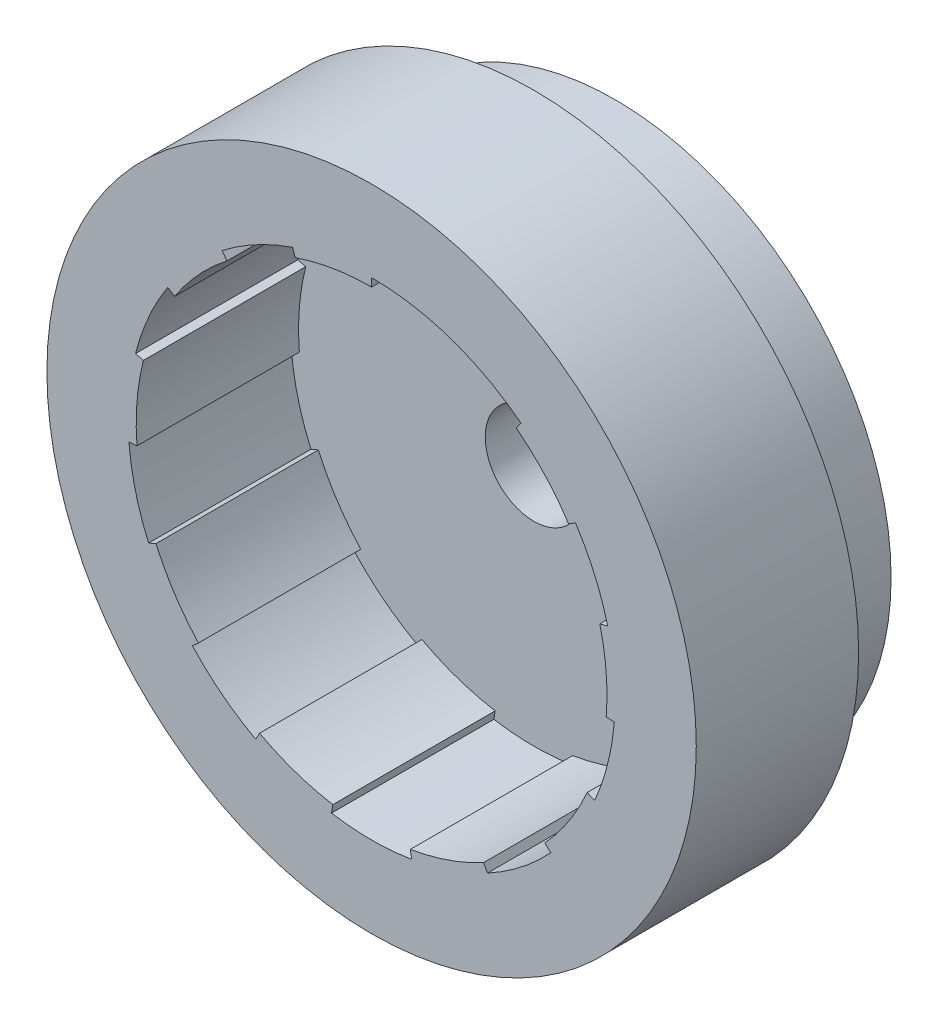
from build123d import *

# Parameters (mm, degrees)
SKETCH1_R           = 20
SKETCH1_R_2         = 15
BOSS_EXTRUDE2_DEPTH = 10
SKETCH2_R           = 17
BOSS_EXTRUDE4_DEPTH = 5
SKETCH5_R           = 3
CUT_EXTRUDE2_DEPTH  = 33.015621187


with BuildPart() as part:
    # Sketch1 → Boss-Extrude2 (new body)
    # profile 1 of 10: a face of its own
    with BuildSketch(Plane.XY):
        Circle(SKETCH1_R)
        Circle(SKETCH1_R_2, mode=Mode.SUBTRACT)
    # profile 2 of 10: a face of its own
    with BuildSketch(Plane.XY):
        with BuildLine():
            ThreePointArc((-4.708142303, 13.714350005), (-2.386621559, 14.302238899), (0, 14.5))
            Line((0, 14.5), (0, 15))
            ThreePointArc((0, 15), (-2.468918854, 14.795419551), (-4.870492038, 14.187258626))
            Line((-4.870492038, 14.187258626), (-4.708142303, 13.714350005))
        make_face()
    # profile 3 of 10: a face of its own
    with BuildSketch(Plane.XY):
        with BuildLine():
            Line((9.21319069, 11.837107641), (8.906084334, 11.442537386))
            ThreePointArc((8.906084334, 11.442537386), (10.667996705, 9.820582789), (12.138913935, 7.930748293))
            Line((12.138913935, 7.930748293), (12.557497174, 8.204222372))
            ThreePointArc((12.557497174, 8.204222372), (11.03585866, 10.159223574), (9.21319069, 11.837107641))
        make_face()
    # profile 4 of 10: a face of its own
    with BuildSketch(Plane.XY):
        with BuildLine():
            Line((14.541003989, 3.682282307), (14.056303856, 3.559539564))
            ThreePointArc((14.056303856, 3.559539564), (14.388648406, 1.793543153), (14.5, 0))
            ThreePointArc((14.5, 0), (14.487613497, -0.599212127), (14.450475149, -1.197400509))
            Line((14.450475149, -1.197400509), (14.948767395, -1.238690182))
            ThreePointArc((14.948767395, -1.238690182), (14.987186376, -0.619874614), (15, 0))
            ThreePointArc((15, 0), (14.884808696, 1.855389469), (14.541003989, 3.682282307))
        make_face()
    # profile 5 of 10: a face of its own
    with BuildSketch(Plane.XY):
        with BuildLine():
            Line((13.7365999, -6.02543137), (13.278713236, -5.824583657))
            ThreePointArc((13.278713236, -5.824583657), (12.138913935, -7.930748293), (10.667996705, -9.820582789))
            Line((10.667996705, -9.820582789), (11.03585866, -10.159223574))
            ThreePointArc((11.03585866, -10.159223574), (12.557497174, -8.204222372), (13.7365999, -6.02543137))
        make_face()
    # profile 6 of 10: a face of its own
    with BuildSketch(Plane.XY):
        with BuildLine():
            Line((7.139210896, -13.192106268), (6.901237199, -12.752369392))
            ThreePointArc((6.901237199, -12.752369392), (4.708142303, -13.714350005), (2.386621559, -14.302238899))
            Line((2.386621559, -14.302238899), (2.468918854, -14.795419551))
            ThreePointArc((2.468918854, -14.795419551), (4.870492038, -14.187258626), (7.139210896, -13.192106268))
        make_face()
    # profile 7 of 10: a face of its own
    with BuildSketch(Plane.XY):
        with BuildLine():
            Line((-2.468918854, -14.795419551), (-2.386621559, -14.302238899))
            ThreePointArc((-2.386621559, -14.302238899), (-4.708142303, -13.714350005), (-6.901237199, -12.752369392))
            Line((-6.901237199, -12.752369392), (-7.139210896, -13.192106268))
            ThreePointArc((-7.139210896, -13.192106268), (-4.870492038, -14.187258626), (-2.468918854, -14.795419551))
        make_face()
    # profile 8 of 10: a face of its own
    with BuildSketch(Plane.XY):
        with BuildLine():
            Line((-11.03585866, -10.159223574), (-10.667996705, -9.820582789))
            ThreePointArc((-10.667996705, -9.820582789), (-12.138913935, -7.930748293), (-13.278713236, -5.824583657))
            Line((-13.278713236, -5.824583657), (-13.7365999, -6.02543137))
            ThreePointArc((-13.7365999, -6.02543137), (-12.557497174, -8.204222372), (-11.03585866, -10.159223574))
        make_face()
    # profile 9 of 10: a face of its own
    with BuildSketch(Plane.XY):
        with BuildLine():
            Line((-14.948767395, -1.238690182), (-14.450475149, -1.197400509))
            ThreePointArc((-14.450475149, -1.197400509), (-14.450475149, 1.197400509), (-14.056303856, 3.559539564))
            Line((-14.056303856, 3.559539564), (-14.541003989, 3.682282307))
            ThreePointArc((-14.541003989, 3.682282307), (-14.948767395, 1.238690182), (-14.948767395, -1.238690182))
        make_face()
    # profile 10 of 10: a face of its own
    with BuildSketch(Plane.XY):
        with BuildLine():
            Line((-12.557497174, 8.204222372), (-12.138913935, 7.930748293))
            ThreePointArc((-12.138913935, 7.930748293), (-10.667996705, 9.820582789), (-8.906084334, 11.442537386))
            Line((-8.906084334, 11.442537386), (-9.21319069, 11.837107641))
            ThreePointArc((-9.21319069, 11.837107641), (-11.03585866, 10.159223574), (-12.557497174, 8.204222372))
        make_face()
    extrude(amount=BOSS_EXTRUDE2_DEPTH)

    # Sketch2 → Boss-Extrude4 (add)
    with BuildSketch(Plane.XY):
        Circle(SKETCH2_R)
    extrude(amount=-BOSS_EXTRUDE4_DEPTH)

    # Sketch5 → Cut-Extrude2 (cut, through all)
    with BuildSketch(Plane(origin=(0, 0, -5), x_dir=(-1, 0, 0), z_dir=(0, 0, -1))):
        Circle(SKETCH5_R)
    extrude(amount=-CUT_EXTRUDE2_DEPTH, mode=Mode.SUBTRACT)


solid = part.part
